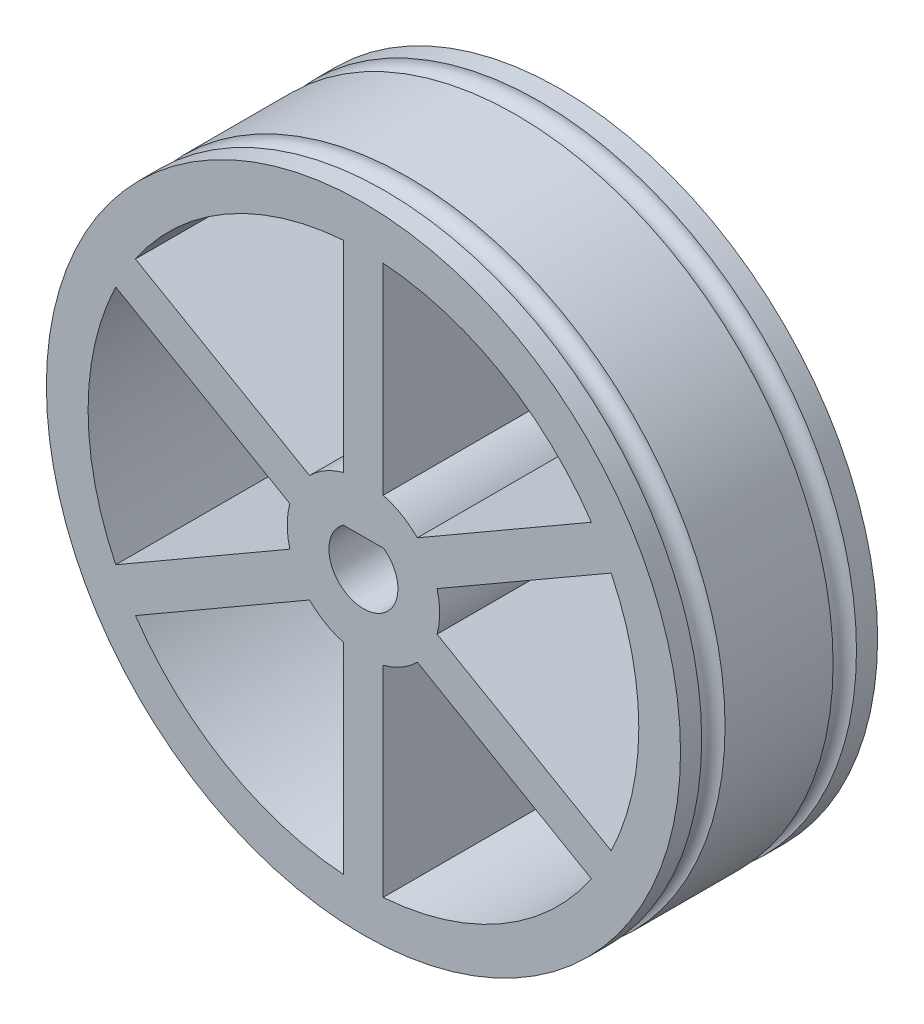
from build123d import *

# Parameters (mm, degrees)
SKETCH1_R             = 24.13
SKETCH1_R_2           = 20.955
BOSS_EXTRUDE1_DEPTH   = 15
SKETCH1_R_3           = 5.8
SKETCH1_R_4           = 2.625
BOSS_EXTRUDE1_2_DEPTH = 15
SKETCH3_W             = 3
SKETCH3_H             = 18.33
BOSS_EXTRUDE3_DEPTH   = 15
CIRPATTERN1_COUNT     = 6
SKETCH4_R             = 0.89
SKETCH5_W             = 5
SKETCH5_H             = 0.5
BOSS_EXTRUDE4_DEPTH   = 15


with BuildPart() as part:
    # Sketch1 → Boss-Extrude1 (new body)
    with BuildSketch(Plane.XY):
        Circle(SKETCH1_R)
        Circle(SKETCH1_R_2, mode=Mode.SUBTRACT)
    extrude(amount=BOSS_EXTRUDE1_DEPTH)



with BuildPart() as body_2:
    # Sketch1 → Boss-Extrude1 2 (new body)
    with BuildSketch(Plane.XY):
        Circle(SKETCH1_R_3)
        Circle(SKETCH1_R_4, mode=Mode.SUBTRACT)
    extrude(amount=BOSS_EXTRUDE1_2_DEPTH)


with BuildPart() as part_1:
    add(part.part)

    add(body_2.part)  # Boss-Extrude3 merges body 2
    # Sketch3 → Boss-Extrude3 (add)
    with BuildSketch(Plane(origin=(0, 0, 0), x_dir=(-1, 0, 0), z_dir=(0, 0, -1))):
        with Locations((0, 11.79)):
            Rectangle(SKETCH3_W, SKETCH3_H)
    boss_extrude3 = extrude(amount=-BOSS_EXTRUDE3_DEPTH)

    # CirPattern1: Boss-Extrude3 ×6 about axis
    cirpattern1_axis = Axis((0, 0, 0), (0, 0, 1))
    for i in range(1, CIRPATTERN1_COUNT):
        add(boss_extrude3.rotate(cirpattern1_axis, i * 360 / CIRPATTERN1_COUNT))

    # Sketch4 → Cut-Revolve1 (revolve, cut)
    with BuildSketch(Plane(origin=(0, 0, 0), x_dir=(0, 0, -1), z_dir=(1, 0, 0)), mode=Mode.PRIVATE) as cut_revolve1_sk:
        with Locations((-12.5, 24.13)):
            Circle(SKETCH4_R)
        with Locations((-2.5, 24.13)):
            Circle(SKETCH4_R)
    revolve(cut_revolve1_sk.sketch.rotate(Axis((0, 0, 0), (0, 0, 1)), 90), axis=Axis((0, 0, 0), (0, 0, 1)), mode=Mode.SUBTRACT)

    # Sketch5 → Boss-Extrude4 (add)
    with BuildSketch(Plane.XY.offset(15)):
        with Locations((0, 2.375)):
            Rectangle(SKETCH5_W, SKETCH5_H)
    extrude(amount=-BOSS_EXTRUDE4_DEPTH)


solid = part_1.part
